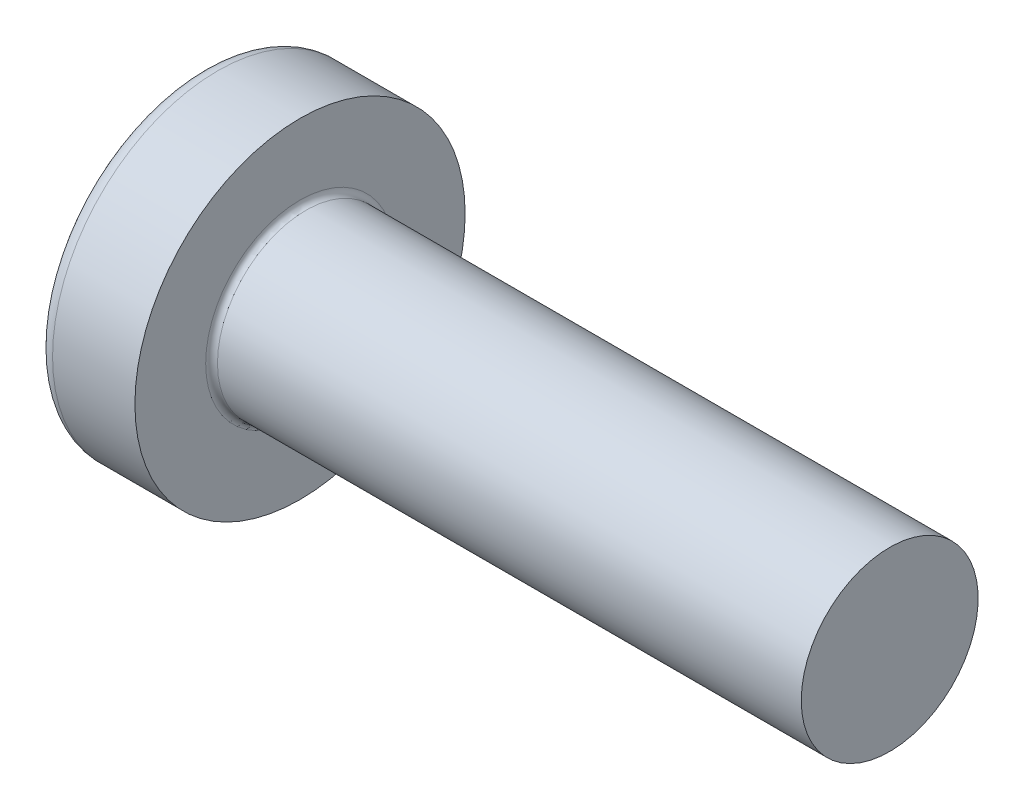
from build123d import *

# Parameters (mm, degrees)
FILLET1_R    = 0.1
RECPAT_COUNT = 2
RECPAT_ANGLE = 90


with BuildPart() as part:
    # BodySke → Base-Revolve (revolve)
    with BuildSketch(Plane.XY, mode=Mode.PRIVATE) as base_revolve_sk:
        with BuildLine():
            Line((2.4, 1.5), (2.4, 2.8))
            Line((2.4, 2.8), (1.003501533, 2.8))
            ThreePointArc((1.003501533, 2.8), (0.873295971, 2.76653015), (0.775371599, 2.674418605))
            ThreePointArc((0.775371599, 2.674418605), (0.197753546, 1.392274756), (0, 0))
            Line((0, 0), (12.4, 0))
            Line((12.4, 0), (12.4, 1.5))
            Line((12.4, 1.5), (2.4, 1.5))
        make_face()
    revolve(base_revolve_sk.sketch.rotate(Axis((1.003501533, 0, 0), (1, 0, 0)), 90), axis=Axis((1.003501533, 0, 0), (1, 0, 0)))

    # Fillet1
    fillet1_edges = [part.edges().sort_by_distance(p)[0] for p in [
        (2.4, 0, -1.5),
    ]]
    fillet(fillet1_edges, radius=FILLET1_R)

    # Sketch3 → Recess section 0
    with BuildSketch(Plane(origin=(0, 0, 0), x_dir=(0, 0, -1), z_dir=(1, 0, 0))):
        with BuildLine():
            Line((0.37, -1.4), (-0.37, -1.4))
            Line((-0.37, -1.4), (-0.37, 1.4))
            Line((-0.37, 1.4), (0.37, 1.4))
            Line((0.37, 1.4), (0.37, -1.4))
        make_face()
    # Sketch4 → Recess section 1
    with BuildSketch(Plane(origin=(1.75, 0, 0), x_dir=(0, 0, -1), z_dir=(1, 0, 0))):
        with BuildLine():
            Line((0.37, -0.527482332), (-0.37, -0.527482332))
            Line((-0.37, -0.527482332), (-0.37, 0.527482332))
            Line((-0.37, 0.527482332), (0.37, 0.527482332))
            Line((0.37, 0.527482332), (0.37, -0.527482332))
        make_face()
    recess = loft(mode=Mode.SUBTRACT)

    # RecPat: Recess ×2 about axis
    recpat_axis = Axis((0, 0, 0), (1, 0, 0))
    for i in range(1, RECPAT_COUNT):
        add(recess.rotate(recpat_axis, i * RECPAT_ANGLE / (RECPAT_COUNT - 1)), mode=Mode.SUBTRACT)

    # RecCorSke → RecessCore (revolve, cut)
    with BuildSketch(Plane.XY, mode=Mode.PRIVATE) as recesscore_sk:
        Polygon((0, 0), (0, 0.678371921), (1.75, 0.556), (1.930655351, 0), align=None)
    revolve(recesscore_sk.sketch.rotate(Axis((-3.175, 0, 0), (1, 0, 0)), 15.814025638), axis=Axis((-3.175, 0, 0), (1, 0, 0)), mode=Mode.SUBTRACT)


solid = part.part
